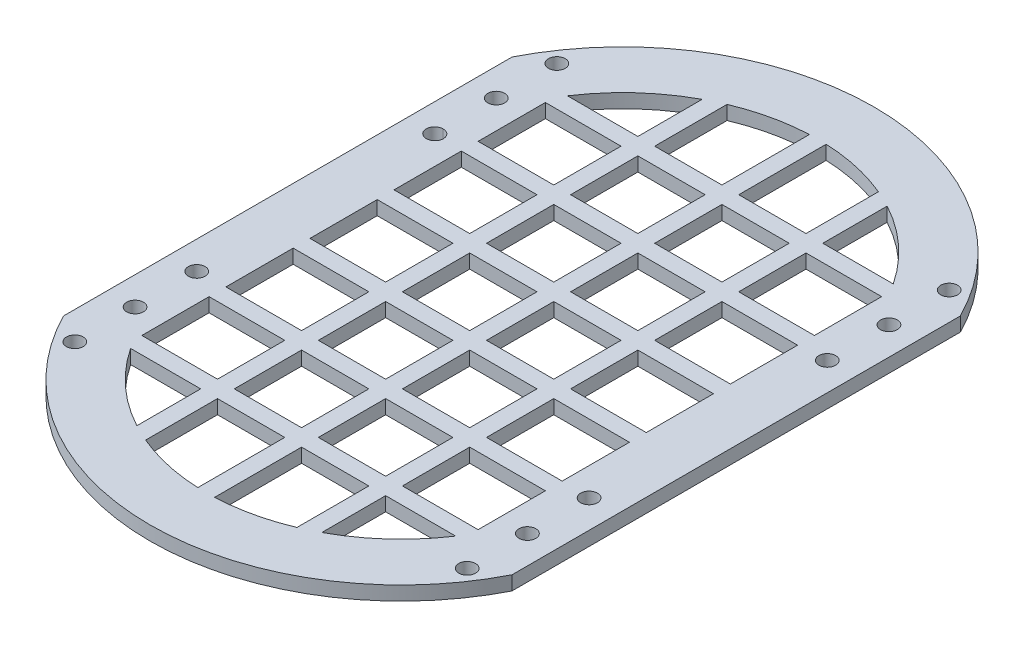
from build123d import *

# Parameters (mm, degrees)
BOSS_EXTRUDE1_DEPTH = 5
SKETCH4_W           = 27
SKETCH4_H           = 24
SKETCH4_W_2         = 24
CUT_EXTRUDE1_DEPTH  = 6
SKETCH5_R           = 3
CUT_EXTRUDE2_DEPTH  = 44
SKETCH6_R           = 3
CUT_EXTRUDE3_DEPTH  = 70
SKETCH7_R           = 3
CUT_EXTRUDE4_DEPTH  = 95


with BuildPart() as part:
    # Sketch1 → Boss-Extrude1 (new body)
    with BuildSketch(Plane(origin=(0, 0, 0), x_dir=(1, 0, 0), z_dir=(0, 1, 0))):
        with BuildLine():
            Line((0, 0), (0, 160))
            ThreePointArc((0, 160), (80, 209.178296965), (160, 160))
            Line((160, 160), (160, 0))
            ThreePointArc((160, 0), (80, -49.178296965), (0, 0))
        make_face()
    extrude(amount=BOSS_EXTRUDE1_DEPTH)

    # Sketch4 → Cut-Extrude1 (cut)
    with BuildSketch(Plane(origin=(0, 5, 0), x_dir=(1, 0, 0), z_dir=(0, 1, 0))):
        with BuildLine():
            Line((21.873652217, 157.907743676), (47, 157.907743676))
            Line((47, 157.907743676), (47, 180.865592736))
            ThreePointArc((47, 180.865592736), (33.013102641, 170.944870409), (21.873652217, 157.907743676))
        make_face()
        with BuildLine():
            Line((53, 157.907743676), (77, 157.907743676))
            Line((77, 157.907743676), (77, 189.11366611))
            ThreePointArc((77, 189.11366611), (64.76062681, 187.490880041), (53, 183.732775763))
            Line((53, 183.732775763), (53, 157.907743676))
        make_face()
        with BuildLine():
            Line((83, 157.907743676), (107, 157.907743676))
            Line((107, 157.907743676), (107, 183.732775763))
            ThreePointArc((107, 183.732775763), (95.23937319, 187.490880041), (83, 189.11366611))
            Line((83, 189.11366611), (83, 157.907743676))
        make_face()
        with BuildLine():
            Line((113, 157.907743676), (138.126347783, 157.907743676))
            ThreePointArc((138.126347783, 157.907743676), (126.986897359, 170.944870409), (113, 180.865592736))
            Line((113, 180.865592736), (113, 157.907743676))
        make_face()
        with Locations((126.5, 139.907743676)):
            Rectangle(SKETCH4_W, SKETCH4_H)
        with Locations((95, 139.907743676)):
            Rectangle(SKETCH4_W_2, SKETCH4_H)
        with Locations((65, 139.907743676)):
            Rectangle(SKETCH4_W_2, SKETCH4_H)
        with Locations((33.5, 139.907743676)):
            Rectangle(SKETCH4_W, SKETCH4_H)
        with Locations((33.5, 109.907743676)):
            Rectangle(SKETCH4_W, SKETCH4_H)
        with Locations((65, 109.907743676)):
            Rectangle(SKETCH4_W_2, SKETCH4_H)
        with Locations((95, 109.907743676)):
            Rectangle(SKETCH4_W_2, SKETCH4_H)
        with Locations((126.5, 109.907743676)):
            Rectangle(SKETCH4_W, SKETCH4_H)
        with Locations((126.5, 79.907743676)):
            Rectangle(SKETCH4_W, SKETCH4_H)
        with Locations((95, 79.907743676)):
            Rectangle(SKETCH4_W_2, SKETCH4_H)
        with Locations((65, 79.907743676)):
            Rectangle(SKETCH4_W_2, SKETCH4_H)
        with Locations((33.5, 79.907743676)):
            Rectangle(SKETCH4_W, SKETCH4_H)
        with Locations((33.5, 49.907743676)):
            Rectangle(SKETCH4_W, SKETCH4_H)
        with Locations((65, 49.907743676)):
            Rectangle(SKETCH4_W_2, SKETCH4_H)
        with Locations((95, 49.907743676)):
            Rectangle(SKETCH4_W_2, SKETCH4_H)
        with Locations((126.5, 49.907743676)):
            Rectangle(SKETCH4_W, SKETCH4_H)
        with Locations((126.5, 19.907743676)):
            Rectangle(SKETCH4_W, SKETCH4_H)
        with Locations((95, 19.907743676)):
            Rectangle(SKETCH4_W_2, SKETCH4_H)
        with Locations((65, 19.907743676)):
            Rectangle(SKETCH4_W_2, SKETCH4_H)
        with Locations((33.5, 19.907743676)):
            Rectangle(SKETCH4_W, SKETCH4_H)
        with BuildLine():
            Line((47, -20.865592736), (47, 1.907743676))
            Line((47, 1.907743676), (21.995929992, 1.907743676))
            ThreePointArc((21.995929992, 1.907743676), (33.09486806, -11.019460066), (47, -20.865592736))
        make_face()
        with BuildLine():
            Line((77, -29.11366611), (77, 1.907743676))
            Line((77, 1.907743676), (53, 1.907743676))
            Line((53, 1.907743676), (53, -23.732775763))
            ThreePointArc((53, -23.732775763), (64.76062681, -27.490880041), (77, -29.11366611))
        make_face()
        with BuildLine():
            Line((107, -23.732775763), (107, 1.907743676))
            Line((107, 1.907743676), (83, 1.907743676))
            Line((83, 1.907743676), (83, -29.11366611))
            ThreePointArc((83, -29.11366611), (95.23937319, -27.490880041), (107, -23.732775763))
        make_face()
        with BuildLine():
            ThreePointArc((113, -20.865592736), (126.90513194, -11.019460066), (138.004070008, 1.907743676))
            Line((138.004070008, 1.907743676), (113, 1.907743676))
            Line((113, 1.907743676), (113, -20.865592736))
        make_face()
    extrude(amount=-CUT_EXTRUDE1_DEPTH, mode=Mode.SUBTRACT)

    # Sketch5 → Cut-Extrude2 (cut)
    with BuildSketch(Plane(origin=(0, 5, 0), x_dir=(1, 0, 0), z_dir=(0, 1, 0))):
        with Locations(Location((10, 37.5, 0), (0, 0, 270))):
            Circle(SKETCH5_R)
        with Locations(Location((150, 37.5, 0), (0, 0, 270))):
            Circle(SKETCH5_R)
        with Locations(Location((150, 122.5, 0), (0, 0, 270))):
            Circle(SKETCH5_R)
        with Locations(Location((10, 122.5, 0), (0, 0, 270))):
            Circle(SKETCH5_R)
    extrude(amount=-CUT_EXTRUDE2_DEPTH, mode=Mode.SUBTRACT)

    # Sketch6 → Cut-Extrude3 (cut)
    with BuildSketch(Plane(origin=(0, 5, 0), x_dir=(1, 0, 0), z_dir=(0, 1, 0))):
        with Locations(Location((9.88568101, 144.5, 0), (0, 0, 270))):
            Circle(SKETCH6_R)
        with Locations((9.88568101, 122.5)):
            Circle(SKETCH6_R)
        with Locations(Location((10, 15.5, 0), (0, 0, 270))):
            Circle(SKETCH6_R)
        with Locations(Location((150, 144.5, 0), (0, 0, 270))):
            Circle(SKETCH6_R)
        with Locations(Location((150, 15.5, 0), (0, 0, 270))):
            Circle(SKETCH6_R)
    extrude(amount=-CUT_EXTRUDE3_DEPTH, mode=Mode.SUBTRACT)

    # Sketch7 → Cut-Extrude4 (cut)
    with BuildSketch(Plane(origin=(0, 5, 0), x_dir=(1, 0, 0), z_dir=(0, 1, 0))):
        with Locations(Location((10, 166, 0), (0, 0, 270))):
            Circle(SKETCH7_R)
        with Locations(Location((150, 166, 0), (0, 0, 270))):
            Circle(SKETCH7_R)
        with Locations(Location((150, -6, 0), (0, 0, 270))):
            Circle(SKETCH7_R)
        with Locations(Location((10, -6, 0), (0, 0, 270))):
            Circle(SKETCH7_R)
    extrude(amount=-CUT_EXTRUDE4_DEPTH, mode=Mode.SUBTRACT)


solid = part.part
